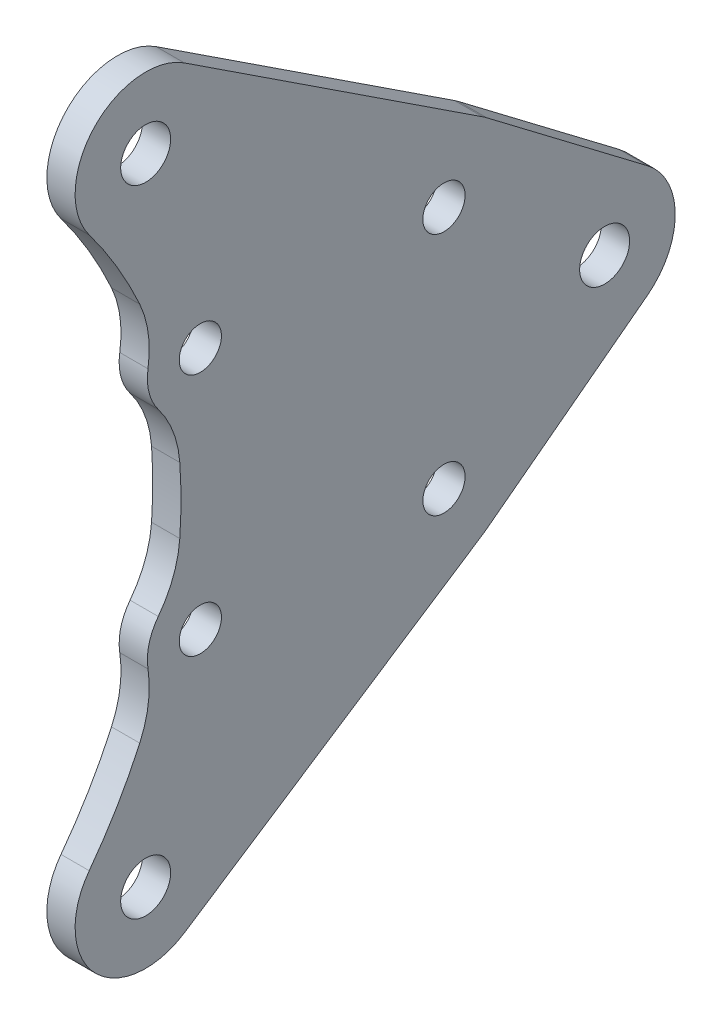
from build123d import *

# Parameters (mm, degrees)
BOSS_EXTRUDE1_DEPTH   = 2.54
F_8_CLEARANCE_HOLE1_D = 4.4958
F_6_CLEARANCE_HOLE1_D = 3.7973


with BuildPart() as part:
    # Sketch1 → Boss-Extrude1 (new body)
    with BuildSketch(Plane(origin=(0, 0, 0), x_dir=(0, 0, -1), z_dir=(1, 0, 0))):
        with BuildLine():
            Line((29.249678303, 5.059653892), (14.797078303, 16.019753892))
            ThreePointArc((14.797078303, 16.019753892), (14.622989145, 16.14717462), (14.444672021, 16.268608061))
            Line((14.444672021, 16.268608061), (-12.390427979, 33.883508061))
            ThreePointArc((-12.390427979, 33.883508061), (-20.503514332, 32.92233885), (-20.955, 24.765))
            ThreePointArc((-20.955, 24.765), (-18.474577219, 21.05577373), (-16.409060049, 17.100461415))
            ThreePointArc((-16.409060049, 17.100461415), (-15.641722595, 14.450337743), (-15.666107705, 11.691467029))
            ThreePointArc((-15.666107705, 11.691467029), (-15.575146808, 9.784196429), (-14.742333624, 8.065948127))
            ThreePointArc((-14.742333624, 8.065948127), (-13.400723388, 5.655129962), (-12.806341132, 2.960937694))
            ThreePointArc((-12.806341132, 2.960937694), (-12.7, 0), (-12.806341132, -2.960937694))
            ThreePointArc((-12.806341132, -2.960937694), (-13.400723388, -5.655129962), (-14.742333624, -8.065948127))
            ThreePointArc((-14.742333624, -8.065948127), (-15.575146808, -9.784196429), (-15.666107705, -11.691467029))
            ThreePointArc((-15.666107705, -11.691467029), (-15.641722595, -14.450337743), (-16.409060049, -17.100461415))
            ThreePointArc((-16.409060049, -17.100461415), (-18.474577219, -21.05577373), (-20.955, -24.765))
            ThreePointArc((-20.955, -24.765), (-20.503514332, -32.92233885), (-12.390427979, -33.883508061))
            Line((-12.390427979, -33.883508061), (14.444672021, -16.268608061))
            ThreePointArc((14.444672021, -16.268608061), (14.622989145, -16.14717462), (14.797078303, -16.019753892))
            Line((14.797078303, -16.019753892), (29.249678303, -5.059653892))
            ThreePointArc((29.249678303, -5.059653892), (31.7627, 0), (29.249678303, 5.059653892))
        make_face()
    extrude(amount=BOSS_EXTRUDE1_DEPTH)

    # #8 Clearance Hole1 (through all)
    with Locations(Plane(origin=(2.54, 0, 0), x_dir=(0, 0, -1), z_dir=(1, 0, 0))):
        with Locations((-15.875, 28.575), (25.4127, 0), (-15.875, -28.575)):
            Hole(F_8_CLEARANCE_HOLE1_D / 2)

    # #6 Clearance Hole1 (through all)
    with Locations(Plane(origin=(2.54, 0, 0), x_dir=(0, 0, -1), z_dir=(1, 0, 0))):
        with Locations((-10.9601, 10.9601), (10.9601, 10.9601), (-10.9601, -10.9601), (10.9601, -10.9601)):
            Hole(F_6_CLEARANCE_HOLE1_D / 2)


solid = part.part
